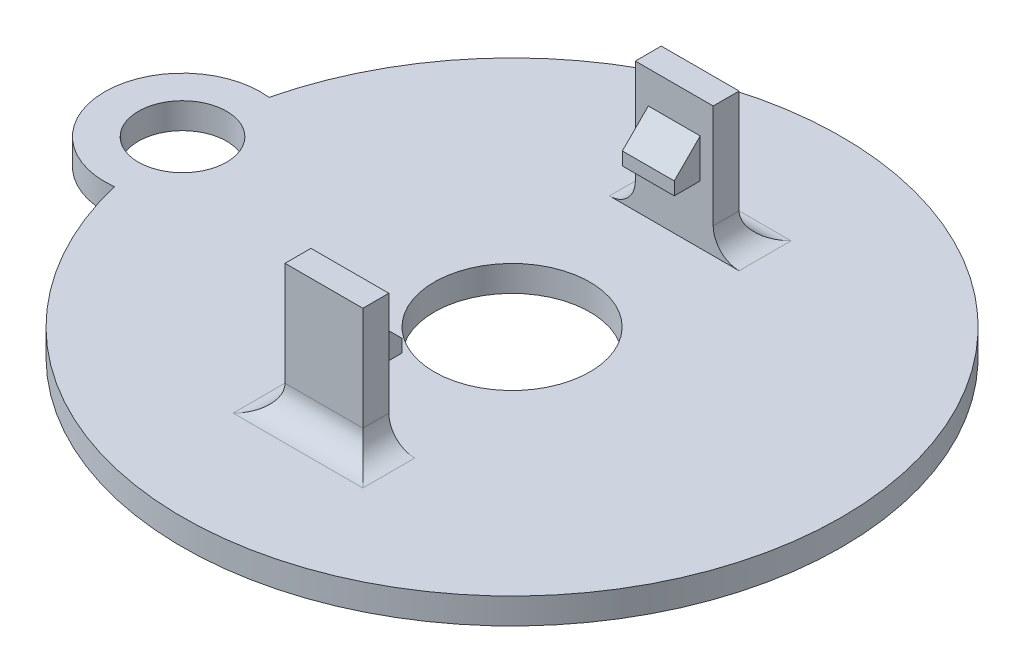
from build123d import *

# Parameters (mm, degrees)
SKETCH2_R                = 3
SKETCH2_R_2              = 1.7
BOSS_EXTRUDE1_DEPTH      = 1
SKETCH3_W                = 3
SKETCH3_H                = 1
BOSS_EXTRUDE2_DEPTH      = 5
BOSS_EXTRUDE3_DEPTH      = 1
BOSS_EXTRUDE3_DEPTH_BACK = 1
FILLET1_R                = 1


with BuildPart() as part:
    # Sketch2 → Boss-Extrude1 (new body)
    with BuildSketch(Plane(origin=(0, 0, 0), x_dir=(1, 0, 0), z_dir=(0, 1, 0))):
        with BuildLine():
            ThreePointArc((-12.345669291, -2.979001468), (12.7, 0), (-12.345669291, 2.979001468))
            ThreePointArc((-12.345669291, 2.979001468), (-15.7, 0), (-12.345669291, -2.979001468))
        make_face()
        with Locations(Location((0, 0, 0), (0, 0, 270))):
            Circle(SKETCH2_R, mode=Mode.SUBTRACT)
        with Locations(Location((-12.7, 0, 0), (0, 0, 270))):
            Circle(SKETCH2_R_2, mode=Mode.SUBTRACT)
    extrude(amount=BOSS_EXTRUDE1_DEPTH)

    # Sketch3 → Boss-Extrude2 (add)
    with BuildSketch(Plane(origin=(0, 1, 0), x_dir=(1, 0, 0), z_dir=(0, 1, 0))):
        with Locations((0, 6.75)):
            Rectangle(SKETCH3_W, SKETCH3_H)
        with Locations((0, -6.75)):
            Rectangle(SKETCH3_W, SKETCH3_H)
    extrude(amount=BOSS_EXTRUDE2_DEPTH)

    # Sketch4 → Boss-Extrude3 (add, two sides: drawn at the far end of the back side and taken through both)
    with BuildSketch(Plane(origin=(0, 0, 0), x_dir=(0, 0, -1), z_dir=(1, 0, 0)).offset(-BOSS_EXTRUDE3_DEPTH_BACK)):
        Polygon((-6.25, 4.75), (-5.25, 3.75), (-5.25, 3.25), (-6.25, 3.25), align=None)
        Polygon((5.25, 3.75), (6.25, 4.75), (6.25, 3.25), (5.25, 3.25), align=None)
    extrude(amount=BOSS_EXTRUDE3_DEPTH + BOSS_EXTRUDE3_DEPTH_BACK)

    # Fillet1
    fillet1_edges = [part.edges().sort_by_distance(p)[0] for p in [
        (-1.5, 1, -6.75),
        (1.5, 1, -6.75),
        (0, 1, -7.25),
        (-1.5, 1, 6.75),
        (0, 1, 7.25),
        (1.5, 1, 6.75),
    ]]
    fillet(fillet1_edges, radius=FILLET1_R)


solid = part.part
